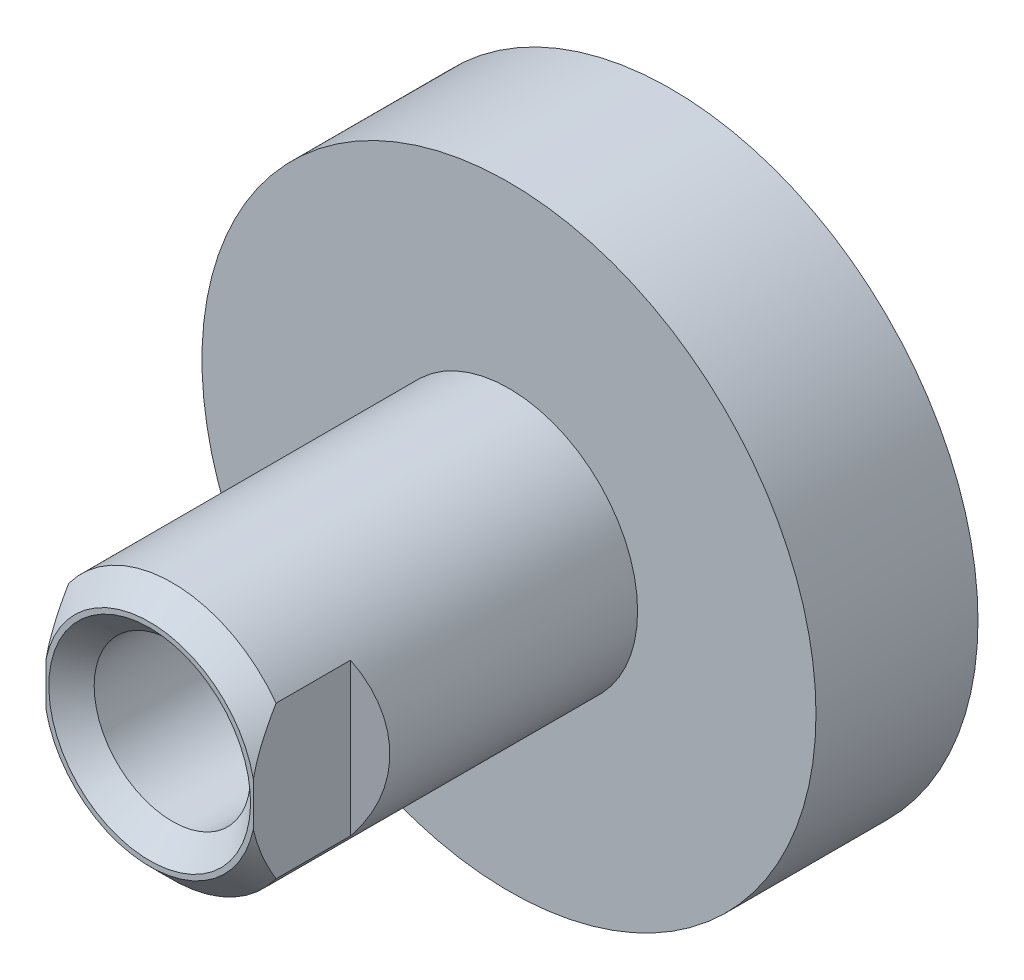
from build123d import *

# Parameters (mm, degrees)
SKETCH1_R                               = 9.475
PISTON_DEPTH                            = 5
SKETCH2_R                               = 3.969
ROD_DEPTH                               = 16.089
F_075_10_32_INTERNAL_THREAD_D           = 4.0386
F_075_10_32_INTERNAL_THREAD_DEPTH       = 11.5
F_075_10_32_INTERNAL_THREAD_CBORE_D     = 4.826
F_075_10_32_INTERNAL_THREAD_CBORE_DEPTH = 9.144
F_075_10_32_INTERNAL_THREAD_TIP         = 1.213317848
ROD_END_CHAMFER_SIZE                    = 0.7
WRENCH_FLATS_DEPTH                      = 21.938174968
WRENCH_FLATS_DEPTH_BACK                 = 21.938174968


with BuildPart() as part:
    # Sketch1 → Piston (new body)
    with BuildSketch(Plane.XY):
        Circle(SKETCH1_R)
    extrude(amount=PISTON_DEPTH)

    # Sketch2 → Rod (add)
    with BuildSketch(Plane(origin=(0, 0, 0), x_dir=(-1, 0, 0), z_dir=(0, 0, -1))):
        with Locations(Location((0, 0, 0), (0, 0, 90))):
            Circle(SKETCH2_R)
    extrude(amount=-ROD_DEPTH)

    # 075 #10-32 Internal Thread
    with Locations(Plane(origin=(0, 0, 16.089), x_dir=(0, 1, 0), z_dir=(0, 0, 1))):
        with Locations((0, 0)):
            CounterBoreHole(F_075_10_32_INTERNAL_THREAD_D / 2, F_075_10_32_INTERNAL_THREAD_CBORE_D / 2, F_075_10_32_INTERNAL_THREAD_CBORE_DEPTH, depth=F_075_10_32_INTERNAL_THREAD_DEPTH)
            with Locations((0, 0, -(F_075_10_32_INTERNAL_THREAD_DEPTH + F_075_10_32_INTERNAL_THREAD_TIP / 2))):  # 118° drill point
                Cone(0, F_075_10_32_INTERNAL_THREAD_D / 2, F_075_10_32_INTERNAL_THREAD_TIP, mode=Mode.SUBTRACT)

    # Rod End Chamfer
    rod_end_chamfer_edges = [part.edges().sort_by_distance(p)[0] for p in [
        (0, -2.413, 16.089),
        (0, -3.969, 16.089),
    ]]
    chamfer(rod_end_chamfer_edges, length=ROD_END_CHAMFER_SIZE)

    # Sketch11 → Wrench Flats (cut, two sides: drawn at the far end of the back side and taken through both)
    with BuildSketch(Plane(origin=(0, 0, 0), x_dir=(1, 0, 0), z_dir=(0, 1, 0)).offset(-WRENCH_FLATS_DEPTH_BACK)):
        Polygon((-3.2, -16.089), (-3.2, -13.089), (-8.2, -10.202248654), (-8.2, -16.089), align=None)
        Polygon((3.2, -16.089), (3.2, -13.089), (8.2, -10.202248654), (8.2, -16.089), align=None)
    extrude(amount=WRENCH_FLATS_DEPTH + WRENCH_FLATS_DEPTH_BACK, mode=Mode.SUBTRACT)


solid = part.part
